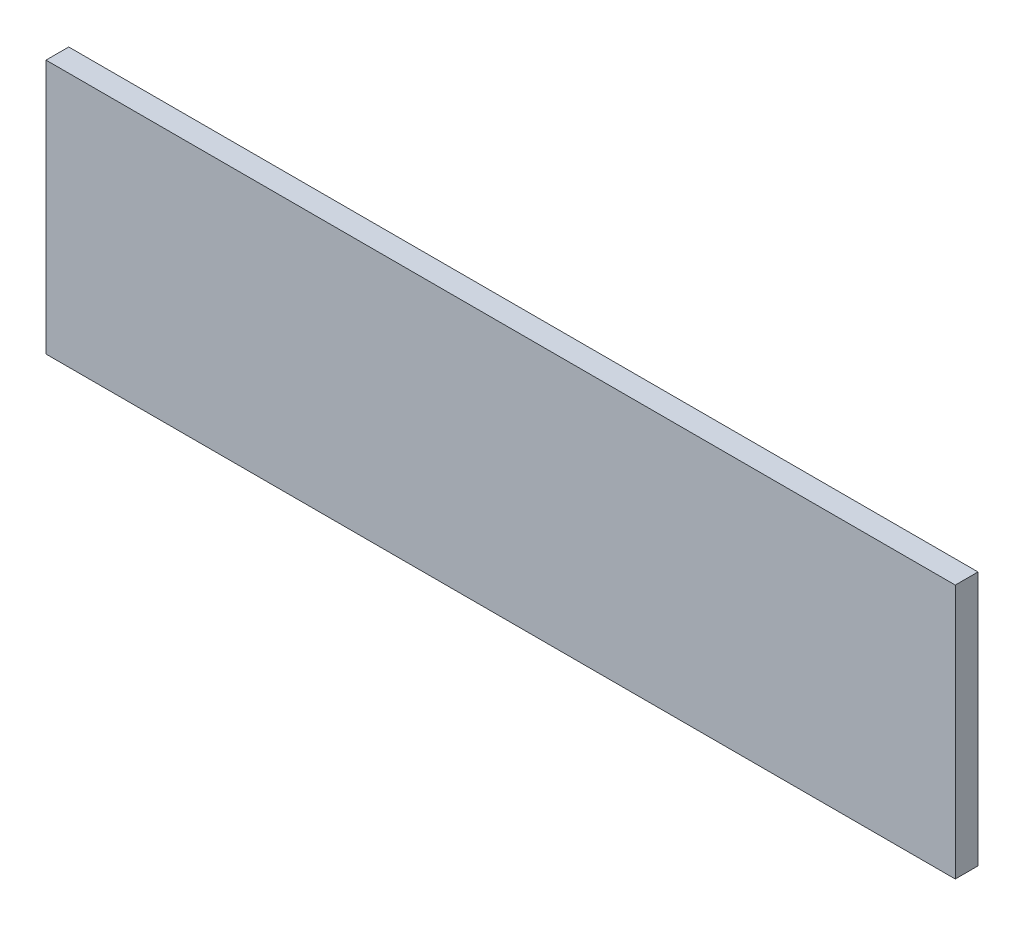
from build123d import *

# Parameters (mm, degrees)
SKETCH1_W           = 127
SKETCH1_H           = 35.56
BOSS_EXTRUDE1_DEPTH = 3.175


with BuildPart() as part:
    # Sketch1 → Boss-Extrude1 (new body)
    with BuildSketch(Plane.XY):
        with Locations((63.5, 17.78)):
            Rectangle(SKETCH1_W, SKETCH1_H)
    extrude(amount=BOSS_EXTRUDE1_DEPTH)


solid = part.part
